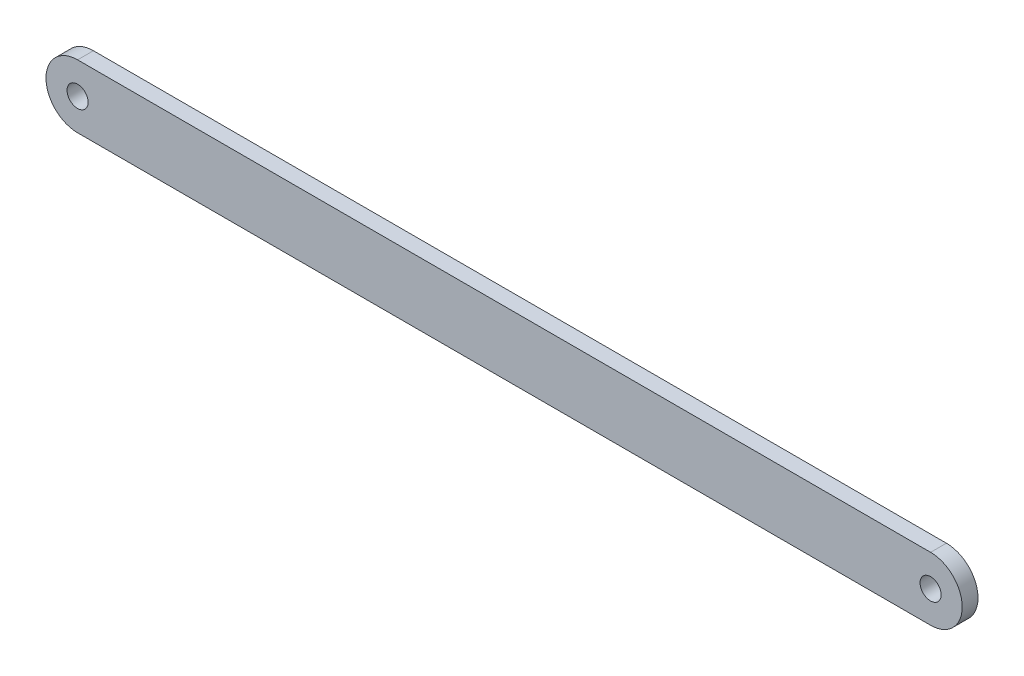
from build123d import *

# Parameters (mm, degrees)
SKETCH1_R           = 2
BOSS_EXTRUDE3_DEPTH = 3


with BuildPart() as part:
    # Sketch1 → Boss-Extrude3 (new body)
    with BuildSketch(Plane.XY):
        with BuildLine():
            Line((-35.312724167, 6), (126.638875833, 6))
            ThreePointArc((126.638875833, 6), (132.638875833, 0), (126.638875833, -6))
            Line((126.638875833, -6), (-35.312724167, -6))
            ThreePointArc((-35.312724167, -6), (-41.312724167, 0), (-35.312724167, 6))
        make_face()
        with Locations((-35.312724167, 0)):
            Circle(SKETCH1_R, mode=Mode.SUBTRACT)
        with Locations((126.638875833, 0)):
            Circle(SKETCH1_R, mode=Mode.SUBTRACT)
    extrude(amount=BOSS_EXTRUDE3_DEPTH)


solid = part.part
